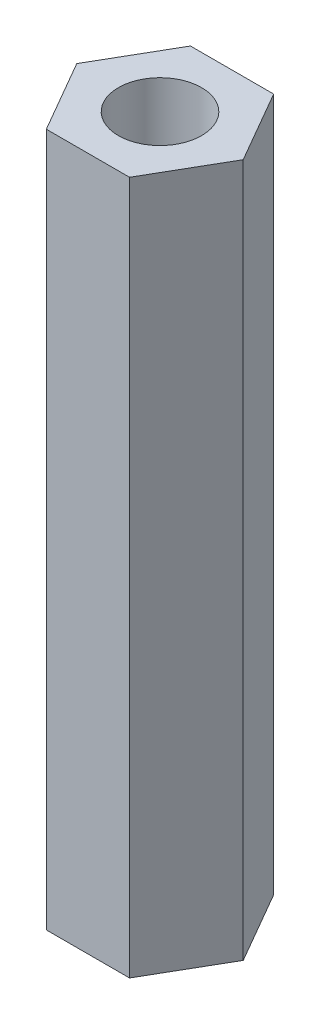
from build123d import *

# Parameters (mm, degrees)
SKETCH1_R           = 1.5
BOSS_EXTRUDE1_DEPTH = 25


with BuildPart() as part:
    # Sketch1 → Boss-Extrude1 (new body)
    with BuildSketch(Plane(origin=(0, 0, 0), x_dir=(1, 0, 0), z_dir=(0, 1, 0))):
        Polygon((-1.5, 2.598076211), (-3, 0), (-1.5, -2.598076211), (1.5, -2.598076211), (3, 0), (1.5, 2.598076211), align=None)
        with Locations(Location((0, 0, 0), (0, 0, 270))):
            Circle(SKETCH1_R, mode=Mode.SUBTRACT)
    extrude(amount=BOSS_EXTRUDE1_DEPTH)


solid = part.part
